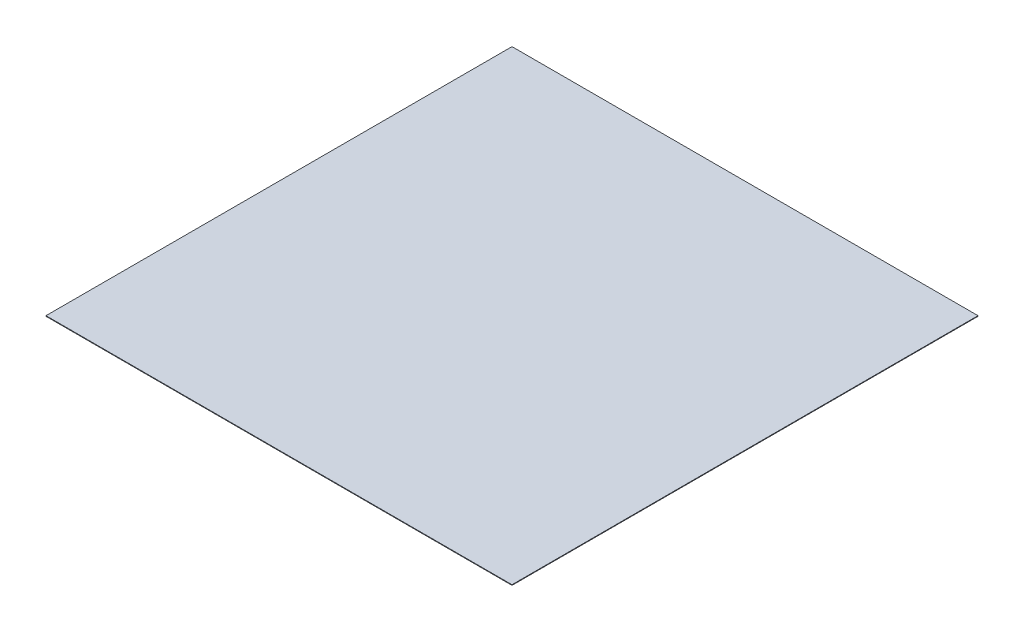
from build123d import *

# Parameters (mm, degrees)
CROQUIS1_W              = 8000
CROQUIS1_H              = 10
SALIENTE_EXTRUIR1_DEPTH = 8000


with BuildPart() as part:
    # Croquis1 → Saliente-Extruir1 (new body)
    with BuildSketch(Plane.XY):
        with Locations((3770.368589744, -73.166666667)):
            Rectangle(CROQUIS1_W, CROQUIS1_H)
    extrude(amount=SALIENTE_EXTRUIR1_DEPTH)


solid = part.part
